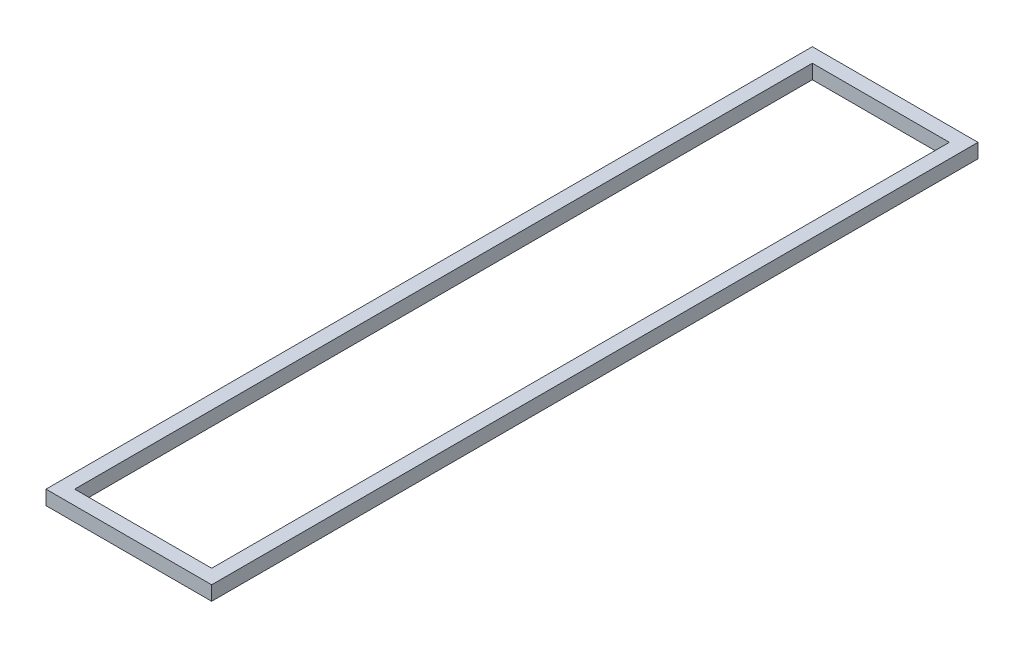
from build123d import *

# Parameters (mm, degrees)
SKETCH1_W      = 293.751
SKETCH1_H      = 1358.9
SKETCH1_W_2    = 242.951
SKETCH1_H_2    = 1308.1
EXTRUDE1_DEPTH = 25.4


with BuildPart() as part:
    # Sketch1 → Extrude1 (new body)
    with BuildSketch(Plane(origin=(0, 0, 0), x_dir=(1, 0, 0), z_dir=(0, 1, 0))):
        with Locations((76.676652699, 622.056653625)):
            Rectangle(SKETCH1_W, SKETCH1_H)
        with Locations((76.676652699, 622.056653625)):
            Rectangle(SKETCH1_W_2, SKETCH1_H_2, mode=Mode.SUBTRACT)
    extrude(amount=EXTRUDE1_DEPTH)


solid = part.part
